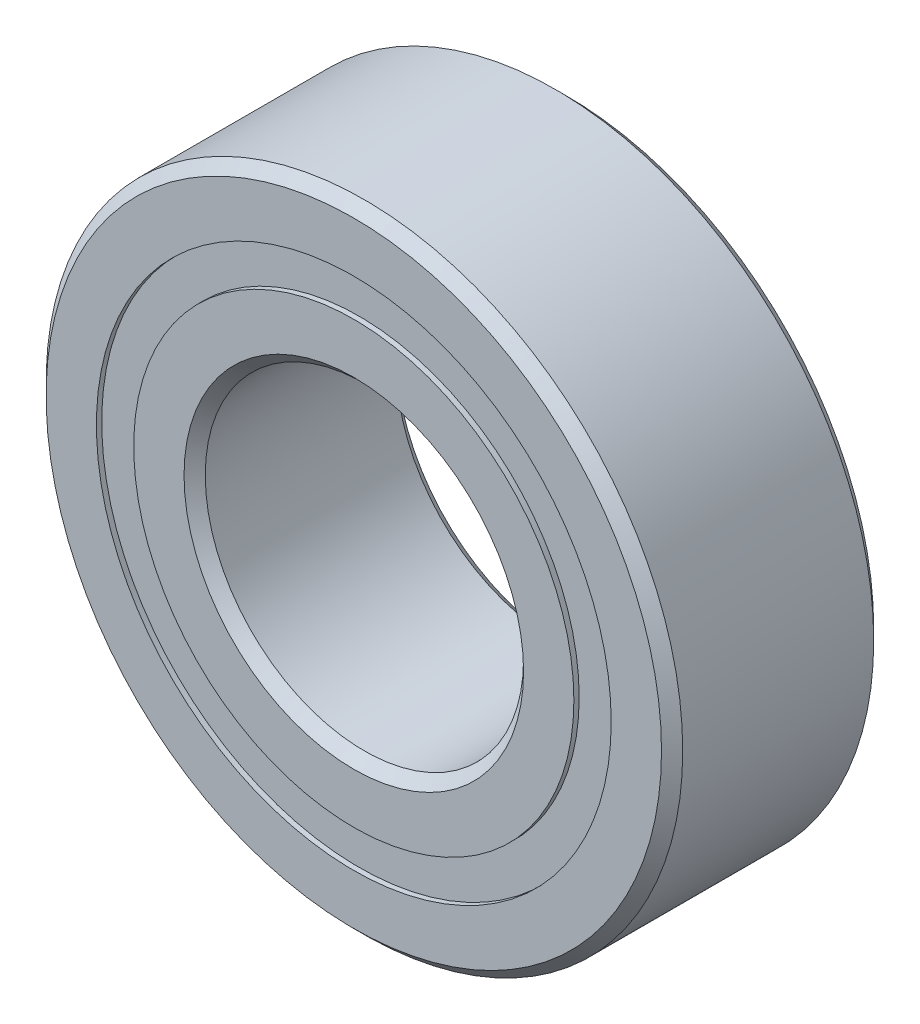
from build123d import *

# Parameters (mm, degrees)
CIRPATTERN1_COUNT = 12
SKETCH5_W         = 0.749364756
SKETCH5_H         = 0.558241758


with BuildPart() as part:
    # Sketch1 → Revolve1 (revolve)
    with BuildSketch(Plane(origin=(0, 0, 0), x_dir=(0, 0, -1), z_dir=(1, 0, 0))):
        with BuildLine():
            Line((1.42875, 4.7625), (-1.42875, 4.7625))
            Line((-1.42875, 4.7625), (-1.5875, 4.60375))
            Line((-1.5875, 4.60375), (-1.5875, 3.850995879))
            Line((-1.5875, 3.850995879), (-0.705555556, 3.850995879))
            ThreePointArc((-0.705555556, 3.850995879), (0, 4.330635244), (0.705555556, 3.850995879))
            Line((0.705555556, 3.850995879), (1.5875, 3.850995879))
            Line((1.5875, 3.850995879), (1.5875, 4.60375))
            Line((1.5875, 4.60375), (1.42875, 4.7625))
        make_face()
    revolve(axis=Axis((0, 0, 1.5875), (0, 0, -1)))


with BuildPart() as body_2:
    # Sketch3 → Revolve3 (revolve)
    with BuildSketch(Plane(origin=(0, 0, 0), x_dir=(0, 0, -1), z_dir=(1, 0, 0))):
        with BuildLine():
            Line((-0.705555556, 3.292754121), (-1.5875, 3.292754121))
            Line((-1.5875, 3.292754121), (-1.5875, 2.54))
            Line((-1.5875, 2.54), (-1.42875, 2.38125))
            Line((-1.42875, 2.38125), (1.42875, 2.38125))
            Line((1.42875, 2.38125), (1.5875, 2.54))
            Line((1.5875, 2.54), (1.5875, 3.292754121))
            Line((1.5875, 3.292754121), (0.705555556, 3.292754121))
            ThreePointArc((0.705555556, 3.292754121), (0, 2.813114756), (-0.705555556, 3.292754121))
        make_face()
    revolve(axis=Axis((0, 0, 1.5875), (0, 0, -1)))


with BuildPart() as body_3:
    # Sketch4 → Revolve4 (revolve)
    with BuildSketch(Plane(origin=(0, 0, 0), x_dir=(0, 0, -1), z_dir=(1, 0, 0))):
        with BuildLine():
            Line((-0.758760244, 3.571875), (0.758760244, 3.571875))
            ThreePointArc((0.758760244, 3.571875), (0, 4.330635244), (-0.758760244, 3.571875))
        make_face()
    revolve(axis=Axis((0, 3.571875, 0.758760244), (0, 0, -1)))


with BuildPart() as cirpattern1_1:
    # CirPattern1: pattern copy
    add(body_3.part.rotate(Axis((0, 0, -1.5875), (0, 0, 1)), 1 * 360 / CIRPATTERN1_COUNT))


with BuildPart() as cirpattern1_2:
    # CirPattern1: pattern copy
    add(body_3.part.rotate(Axis((0, 0, -1.5875), (0, 0, 1)), 2 * 360 / CIRPATTERN1_COUNT))


with BuildPart() as cirpattern1_3:
    # CirPattern1: pattern copy
    add(body_3.part.rotate(Axis((0, 0, -1.5875), (0, 0, 1)), 3 * 360 / CIRPATTERN1_COUNT))


with BuildPart() as cirpattern1_4:
    # CirPattern1: pattern copy
    add(body_3.part.rotate(Axis((0, 0, -1.5875), (0, 0, 1)), 4 * 360 / CIRPATTERN1_COUNT))


with BuildPart() as cirpattern1_5:
    # CirPattern1: pattern copy
    add(body_3.part.rotate(Axis((0, 0, -1.5875), (0, 0, 1)), 5 * 360 / CIRPATTERN1_COUNT))


with BuildPart() as cirpattern1_6:
    # CirPattern1: pattern copy
    add(body_3.part.rotate(Axis((0, 0, -1.5875), (0, 0, 1)), 6 * 360 / CIRPATTERN1_COUNT))


with BuildPart() as cirpattern1_7:
    # CirPattern1: pattern copy
    add(body_3.part.rotate(Axis((0, 0, -1.5875), (0, 0, 1)), 7 * 360 / CIRPATTERN1_COUNT))


with BuildPart() as cirpattern1_8:
    # CirPattern1: pattern copy
    add(body_3.part.rotate(Axis((0, 0, -1.5875), (0, 0, 1)), 8 * 360 / CIRPATTERN1_COUNT))


with BuildPart() as cirpattern1_9:
    # CirPattern1: pattern copy
    add(body_3.part.rotate(Axis((0, 0, -1.5875), (0, 0, 1)), 9 * 360 / CIRPATTERN1_COUNT))


with BuildPart() as cirpattern1_10:
    # CirPattern1: pattern copy
    add(body_3.part.rotate(Axis((0, 0, -1.5875), (0, 0, 1)), 10 * 360 / CIRPATTERN1_COUNT))


with BuildPart() as cirpattern1_11:
    # CirPattern1: pattern copy
    add(body_3.part.rotate(Axis((0, 0, -1.5875), (0, 0, 1)), 11 * 360 / CIRPATTERN1_COUNT))


with BuildPart() as body_15:
    # Sketch5 → Revolve5 (revolve)
    with BuildSketch(Plane(origin=(0, 0, 0), x_dir=(0, 0, -1), z_dir=(1, 0, 0))):
        with Locations((-1.133442622, 3.571875)):
            Rectangle(SKETCH5_W, SKETCH5_H)
        with Locations((1.133442622, 3.571875)):
            Rectangle(SKETCH5_W, SKETCH5_H)
    revolve(axis=Axis((0, 0, 1.5875), (0, 0, -1)))


solid = Compound([part.part, body_2.part, body_3.part, cirpattern1_1.part, cirpattern1_2.part, cirpattern1_3.part, cirpattern1_4.part, cirpattern1_5.part, cirpattern1_6.part, cirpattern1_7.part, cirpattern1_8.part, cirpattern1_9.part, cirpattern1_10.part, cirpattern1_11.part, body_15.part])
